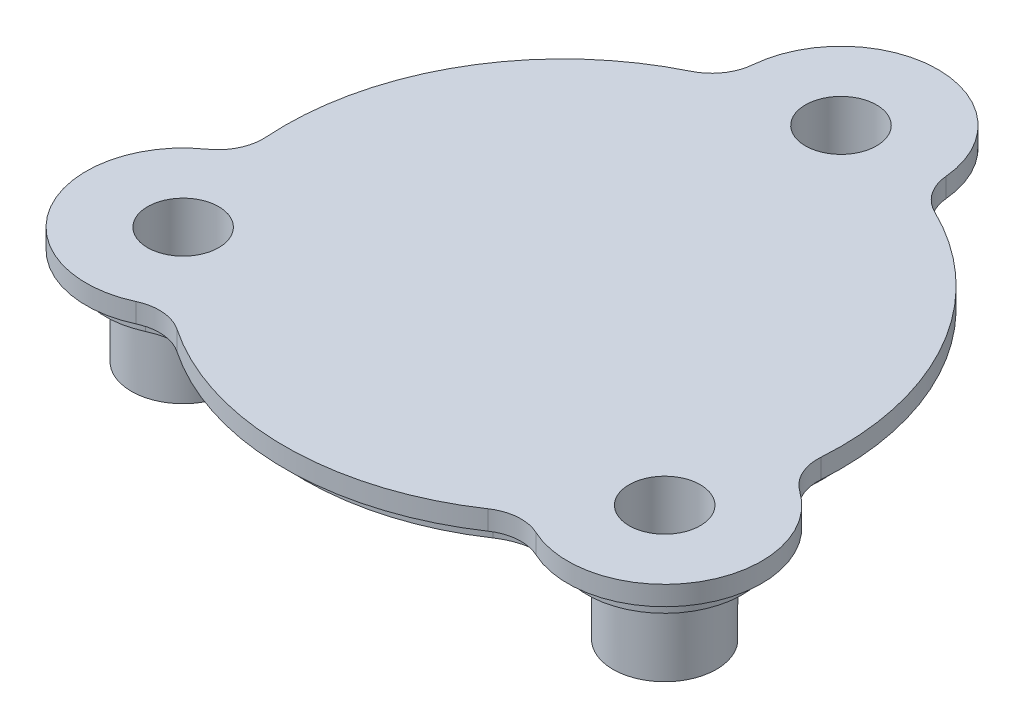
from build123d import *

# Parameters (mm, degrees)
SKETCH1_R             = 8
SKETCH1_R_2           = 3
BOSS_EXTRUDE1_DEPTH   = 6
BOSS_EXTRUDE1_2_DEPTH = 6
BOSS_EXTRUDE1_3_DEPTH = 6
BOSS_EXTRUDE3_START   = 18
SKETCH1_4_R           = 5.5
BOSS_EXTRUDE3_DEPTH   = 3
SKETCH1_3_R           = 8
SKETCH1_3_R_2         = 5.5
BOSS_EXTRUDE2_DEPTH   = 18
BOSS_EXTRUDE4_START   = 3
SKETCH2_R             = 8
BOSS_EXTRUDE4_DEPTH   = 3


with BuildPart() as part:
    # Sketch1 → Boss-Extrude1 (new body)
    with BuildSketch(Plane(origin=(0, 0, 0), x_dir=(1, 0, 0), z_dir=(0, 1, 0))):
        with Locations(Location((0, 43, 0), (0, 0, 270))):
            Circle(SKETCH1_R)
        with Locations(Location((0, 43, 0), (0, 0, 270))):
            Circle(SKETCH1_R_2, mode=Mode.SUBTRACT)
    extrude(amount=BOSS_EXTRUDE1_DEPTH)



with BuildPart() as body_2:
    # Sketch1 → Boss-Extrude1 2 (new body)
    with BuildSketch(Plane(origin=(0, 0, 0), x_dir=(1, 0, 0), z_dir=(0, 1, 0))):
        with Locations(Location((37.239092363, -21.5, 0), (0, 0, 270))):
            Circle(SKETCH1_R)
        with Locations(Location((37.239092363, -21.5, 0), (0, 0, 270))):
            Circle(SKETCH1_R_2, mode=Mode.SUBTRACT)
    extrude(amount=BOSS_EXTRUDE1_2_DEPTH)


with BuildPart() as body_3:
    # Sketch1 → Boss-Extrude1 3 (new body)
    with BuildSketch(Plane(origin=(0, 0, 0), x_dir=(1, 0, 0), z_dir=(0, 1, 0))):
        with Locations(Location((-37.239092363, -21.5, 0), (0, 0, 270))):
            Circle(SKETCH1_R)
        with Locations(Location((-37.239092363, -21.5, 0), (0, 0, 270))):
            Circle(SKETCH1_R_2, mode=Mode.SUBTRACT)
    extrude(amount=BOSS_EXTRUDE1_3_DEPTH)


with BuildPart() as body_4:
    # Sketch1<4> → Boss-Extrude3 (new body)
    with BuildSketch(Plane(origin=(0, 0, 0), x_dir=(1, 0, 0), z_dir=(0, 1, 0)).offset(BOSS_EXTRUDE3_START)):
        with BuildLine():
            ThreePointArc((14.941453584, 44.323995772), (0, 58), (-14.941453584, 44.323995772))
            ThreePointArc((-14.941453584, 44.323995772), (-16.147655157, 40.973517523), (-18.846153454, 38.65))
            ThreePointArc((-18.846153454, 38.65), (-37.239092363, 21.5), (-42.894958583, -3.003752345))
            ThreePointArc((-42.894958583, -3.003752345), (-43.557934635, -6.502479184), (-45.856433127, -9.222319513))
            ThreePointArc((-45.856433127, -9.222319513), (-50.229473419, -29), (-30.914979544, -35.101676259))
            ThreePointArc((-30.914979544, -35.101676259), (-27.410279478, -34.471038339), (-24.048805129, -35.646247655))
            ThreePointArc((-24.048805129, -35.646247655), (0, -43), (24.048805129, -35.646247655))
            ThreePointArc((24.048805129, -35.646247655), (27.410279478, -34.471038339), (30.914979544, -35.101676259))
            ThreePointArc((30.914979544, -35.101676259), (50.229473419, -29), (45.856433127, -9.222319513))
            ThreePointArc((45.856433127, -9.222319513), (43.557934635, -6.502479184), (42.894958583, -3.003752345))
            ThreePointArc((42.894958583, -3.003752345), (37.239092363, 21.5), (18.846153454, 38.65))
            ThreePointArc((18.846153454, 38.65), (16.147655157, 40.973517523), (14.941453584, 44.323995772))
        make_face()
        with Locations(Location((0, 43, 0), (0, 0, 270))):
            Circle(SKETCH1_4_R, mode=Mode.SUBTRACT)
        with Locations(Location((37.239092363, -21.5, 0), (0, 0, 270))):
            Circle(SKETCH1_4_R, mode=Mode.SUBTRACT)
        with Locations(Location((-37.239092363, -21.5, 0), (0, 0, 270))):
            Circle(SKETCH1_4_R, mode=Mode.SUBTRACT)
    extrude(amount=-BOSS_EXTRUDE3_DEPTH)


with BuildPart() as part_1:
    add(part.part)

    add(body_2.part)  # Boss-Extrude2 merges body 2

    add(body_3.part)  # Boss-Extrude2 merges body 3

    add(body_4.part)  # Boss-Extrude2 merges body 4
    # Sketch1<3> → Boss-Extrude2 (add)
    # profile 1 of 3: a face of its own
    with BuildSketch(Plane(origin=(0, 0, 0), x_dir=(1, 0, 0), z_dir=(0, 1, 0))):
        with Locations(Location((-37.239092363, -21.5, 0), (0, 0, 270))):
            Circle(SKETCH1_3_R)
        with Locations(Location((-37.239092363, -21.5, 0), (0, 0, 270))):
            Circle(SKETCH1_3_R_2, mode=Mode.SUBTRACT)
    # profile 2 of 3: a face of its own
    with BuildSketch(Plane(origin=(0, 0, 0), x_dir=(1, 0, 0), z_dir=(0, 1, 0))):
        with Locations(Location((37.239092363, -21.5, 0), (0, 0, 270))):
            Circle(SKETCH1_3_R)
        with Locations(Location((37.239092363, -21.5, 0), (0, 0, 270))):
            Circle(SKETCH1_3_R_2, mode=Mode.SUBTRACT)
    # profile 3 of 3: a face of its own
    with BuildSketch(Plane(origin=(0, 0, 0), x_dir=(1, 0, 0), z_dir=(0, 1, 0))):
        with Locations(Location((0, 43, 0), (0, 0, 270))):
            Circle(SKETCH1_3_R)
        with Locations(Location((0, 43, 0), (0, 0, 270))):
            Circle(SKETCH1_3_R_2, mode=Mode.SUBTRACT)
    extrude(amount=BOSS_EXTRUDE2_DEPTH)

    # Sketch2 → Boss-Extrude4 (add)
    with BuildSketch(Plane.XZ.offset(-15).offset(BOSS_EXTRUDE4_START)):
        with BuildLine():
            ThreePointArc((-39.902287054, 2.794188228), (-34.641016151, -20), (-17.531305538, -35.953488372))
            ThreePointArc((-17.531305538, -35.953488372), (-13.676307972, -39.272799119), (-11.953162867, -44.059196617))
            ThreePointArc((-11.953162867, -44.059196617), (0, -55), (11.953162867, -44.059196617))
            ThreePointArc((11.953162867, -44.059196617), (13.676307972, -39.272799119), (17.531305538, -35.953488372))
            ThreePointArc((17.531305538, -35.953488372), (34.641016151, -20), (39.902287054, 2.794188228))
            ThreePointArc((39.902287054, 2.794188228), (40.8493957, 7.792369426), (44.132964974, 11.67785561))
            ThreePointArc((44.132964974, 11.67785561), (47.631397208, 27.5), (32.179802107, 32.381341007))
            ThreePointArc((32.179802107, 32.381341007), (27.173087728, 31.480429693), (22.370981516, 33.159300144))
            ThreePointArc((22.370981516, 33.159300144), (0, 40), (-22.370981516, 33.159300144))
            ThreePointArc((-22.370981516, 33.159300144), (-27.173087728, 31.480429693), (-32.179802107, 32.381341007))
            ThreePointArc((-32.179802107, 32.381341007), (-47.631397208, 27.5), (-44.132964974, 11.67785561))
            ThreePointArc((-44.132964974, 11.67785561), (-40.8493957, 7.792369426), (-39.902287054, 2.794188228))
        make_face()
        with Locations(Location((0, -43, 0), (0, 0, 270))):
            Circle(SKETCH2_R, mode=Mode.SUBTRACT)
        with Locations(Location((37.239092363, 21.5, 0), (0, 0, 270))):
            Circle(SKETCH2_R, mode=Mode.SUBTRACT)
        with Locations(Location((-37.239092363, 21.5, 0), (0, 0, 270))):
            Circle(SKETCH2_R, mode=Mode.SUBTRACT)
    extrude(amount=-BOSS_EXTRUDE4_DEPTH)


solid = part_1.part
